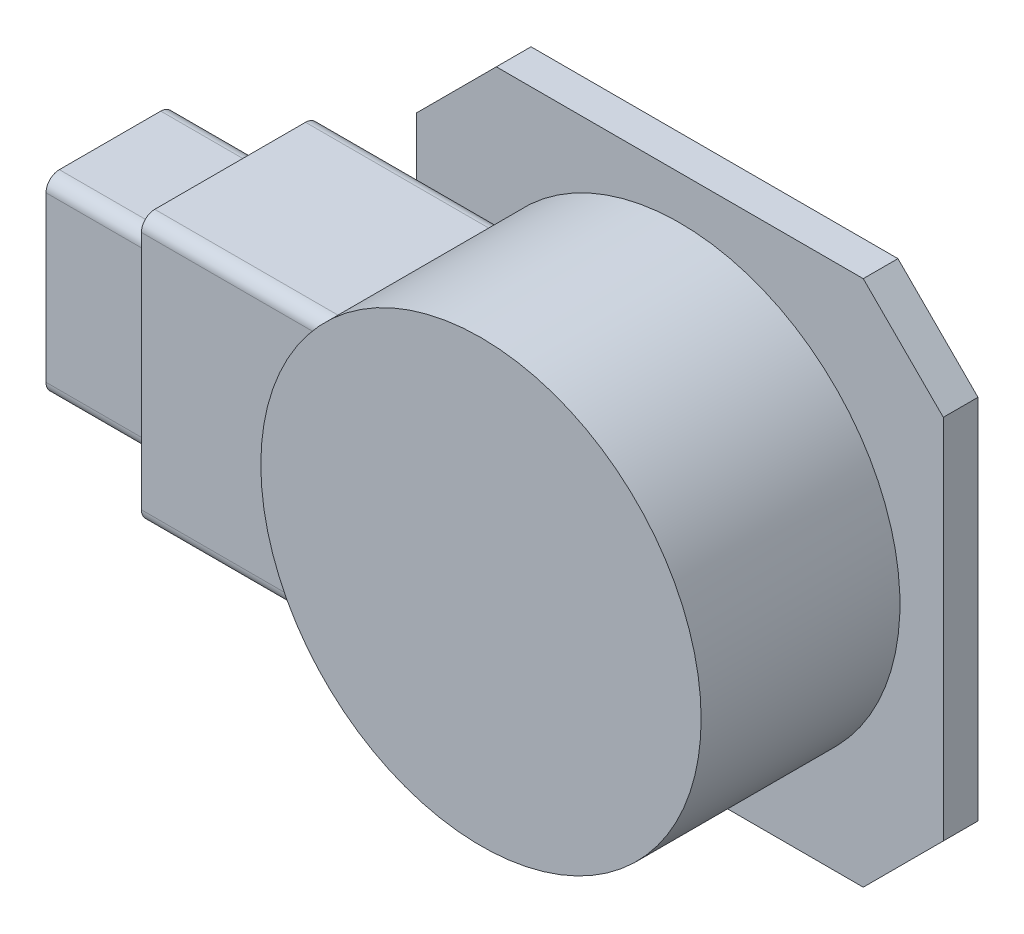
from build123d import *

# Parameters (mm, degrees)
EXTRUDE_1_DEPTH = 26
SKETCH_3_R      = 165
EXTRUDE_2_DEPTH = 149
EXTRUDE_3_DEPTH = 270.5
EXTRUDE_4_DEPTH = 90


with BuildPart() as part:
    # 草圖1 → 填料-伸長1 (new body)
    with BuildSketch(Plane.XY):
        Polygon((-197.5, 137.5), (-137.5, 197.5), (137.5, 197.5), (197.5, 137.5), (197.5, -137.5), (137.5, -197.5), (-137.5, -197.5), (-197.5, -137.5), align=None)
    extrude(amount=EXTRUDE_1_DEPTH)

    # 草圖3 → 填料-伸長2 (add)
    with BuildSketch(Plane.XY.offset(26)):
        Circle(SKETCH_3_R)
    extrude(amount=EXTRUDE_2_DEPTH)

    # 草圖4 → 填料-伸長3 (add)
    with BuildSketch(Plane(origin=(0, 0, 0), x_dir=(0, 0, -1), z_dir=(1, 0, 0))):
        with BuildLine():
            Line((-36, 100), (-149, 100))
            ThreePointArc((-149, 100), (-156.071067812, 97.071067812), (-159, 90))
            Line((-159, 90), (-159, -90))
            ThreePointArc((-159, -90), (-156.071067812, -97.071067812), (-149, -100))
            Line((-149, -100), (-36, -100))
            ThreePointArc((-36, -100), (-28.928932188, -97.071067812), (-26, -90))
            Line((-26, -90), (-26, 90))
            ThreePointArc((-26, 90), (-28.928932188, 97.071067812), (-36, 100))
        make_face()
    extrude(amount=-EXTRUDE_3_DEPTH)

    # 草圖5 → 填料-伸長4 (add)
    with BuildSketch(Plane.ZY.offset(270.5)):
        with BuildLine():
            Line((54.5, 71.5), (130.5, 71.5))
            ThreePointArc((130.5, 71.5), (137.571067812, 68.571067812), (140.5, 61.5))
            Line((140.5, 61.5), (140.5, -61.5))
            ThreePointArc((140.5, -61.5), (137.571067812, -68.571067812), (130.5, -71.5))
            Line((130.5, -71.5), (54.5, -71.5))
            ThreePointArc((54.5, -71.5), (47.428932188, -68.571067812), (44.5, -61.5))
            Line((44.5, -61.5), (44.5, 61.5))
            ThreePointArc((44.5, 61.5), (47.428932188, 68.571067812), (54.5, 71.5))
        make_face()
    extrude(amount=EXTRUDE_4_DEPTH)


solid = part.part
